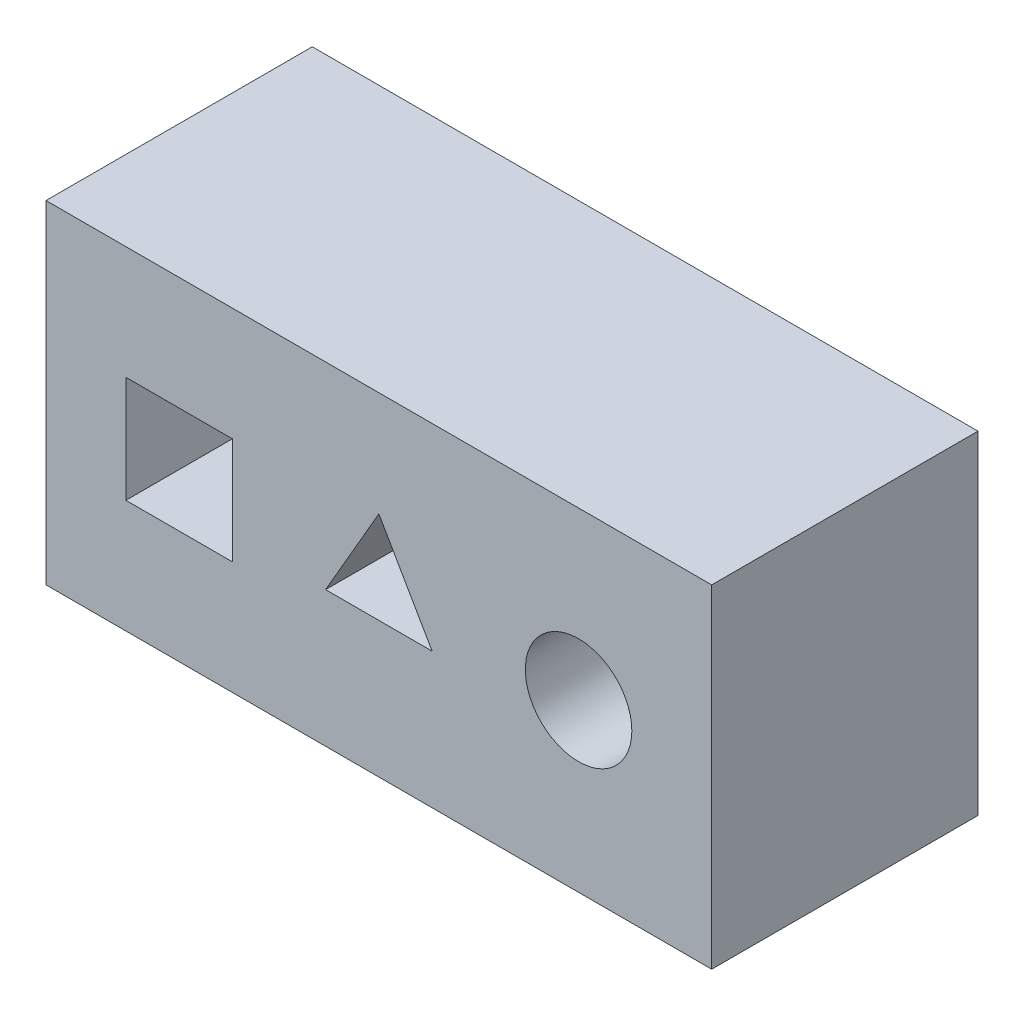
from build123d import *

# Parameters (mm, degrees)
SKETCH1_W           = 250
SKETCH1_H           = 125
SKETCH1_W_2         = 230
SKETCH1_H_2         = 115
BOSS_EXTRUDE1_DEPTH = 100
SKETCH3_W           = 250
SKETCH3_H           = 125
SKETCH3_W_2         = 230
SKETCH3_H_2         = 115
SKETCH3_R           = 20
SKETCH3_W_3         = 40
SKETCH3_H_3         = 40
BOSS_EXTRUDE4_DEPTH = 100


with BuildPart() as part:
    # Sketch1 → Boss-Extrude1 (new body)
    with BuildSketch(Plane.XY):
        Rectangle(SKETCH1_W, SKETCH1_H)
        Rectangle(SKETCH1_W_2, SKETCH1_H_2, mode=Mode.SUBTRACT)
    extrude(amount=BOSS_EXTRUDE1_DEPTH)

    # Sketch3 → Boss-Extrude4 (add)
    # profile 1 of 2: a face of its own
    with BuildSketch(Plane.XY.offset(100)):
        Rectangle(SKETCH3_W, SKETCH3_H)
        Rectangle(SKETCH3_W_2, SKETCH3_H_2, mode=Mode.SUBTRACT)
    # profile 2 of 2: a face of its own
    with BuildSketch(Plane.XY.offset(100)):
        Rectangle(SKETCH3_W_2, SKETCH3_H_2)
        with Locations((75, 0)):
            Circle(SKETCH3_R, mode=Mode.SUBTRACT)
        with Locations((-75, 0)):
            Rectangle(SKETCH3_W_3, SKETCH3_H_3, mode=Mode.SUBTRACT)
        Polygon((0, 23.094010768), (20, -11.547005384), (-20, -11.547005384), align=None, mode=Mode.SUBTRACT)
    extrude(amount=-BOSS_EXTRUDE4_DEPTH)


solid = part.part
